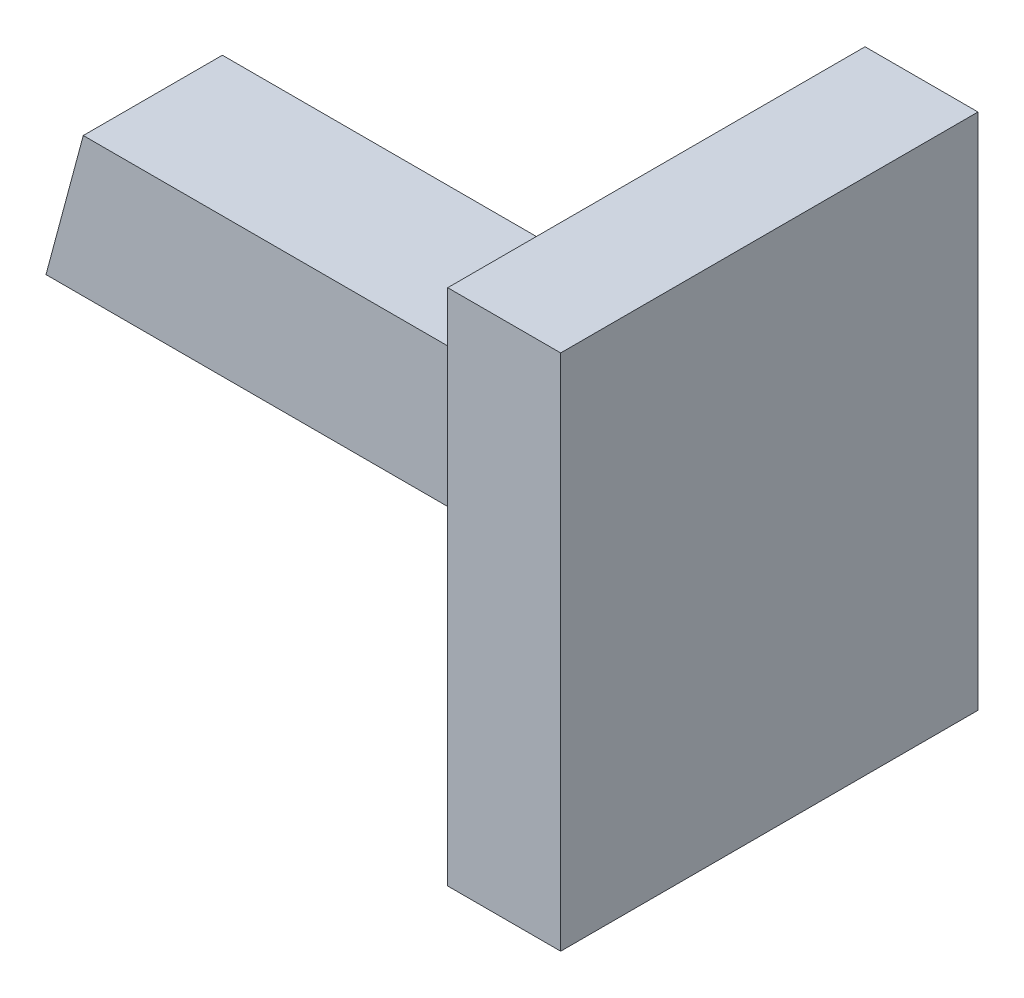
from build123d import *

# Parameters (mm, degrees)
SKETCH1_W                = 47
SKETCH1_H                = 10
BOSS_EXTRUDE1_DEPTH      = 10
BOSS_EXTRUDE3_DEPTH      = 15
BOSS_EXTRUDE3_DEPTH_BACK = 15
SKETCH5_W                = 8.120903277
SKETCH5_H                = 37.25
CUT_EXTRUDE1_DEPTH       = 57.27735446


with BuildPart() as part:
    # Sketch1 → Boss-Extrude1 (new body)
    with BuildSketch(Plane.XY):
        with Locations((23.5, 5)):
            Rectangle(SKETCH1_W, SKETCH1_H)
    extrude(amount=BOSS_EXTRUDE1_DEPTH)

    # Sketch5 → Boss-Extrude3 (add, two sides: drawn at the far end of the back side and taken through both)
    with BuildSketch(Plane.XY.offset(5).offset(-BOSS_EXTRUDE3_DEPTH_BACK)):
        with Locations((42.939548362, 5)):
            Rectangle(SKETCH5_W, SKETCH5_H)
    extrude(amount=BOSS_EXTRUDE3_DEPTH + BOSS_EXTRUDE3_DEPTH_BACK)

    # Sketch6 → Cut-Extrude1 (cut, through all)
    with BuildSketch(Plane.XY.offset(10)):
        Polygon((0, 10), (2.679491924, 10), (0, 0), align=None)
    extrude(amount=-CUT_EXTRUDE1_DEPTH, mode=Mode.SUBTRACT)


solid = part.part
